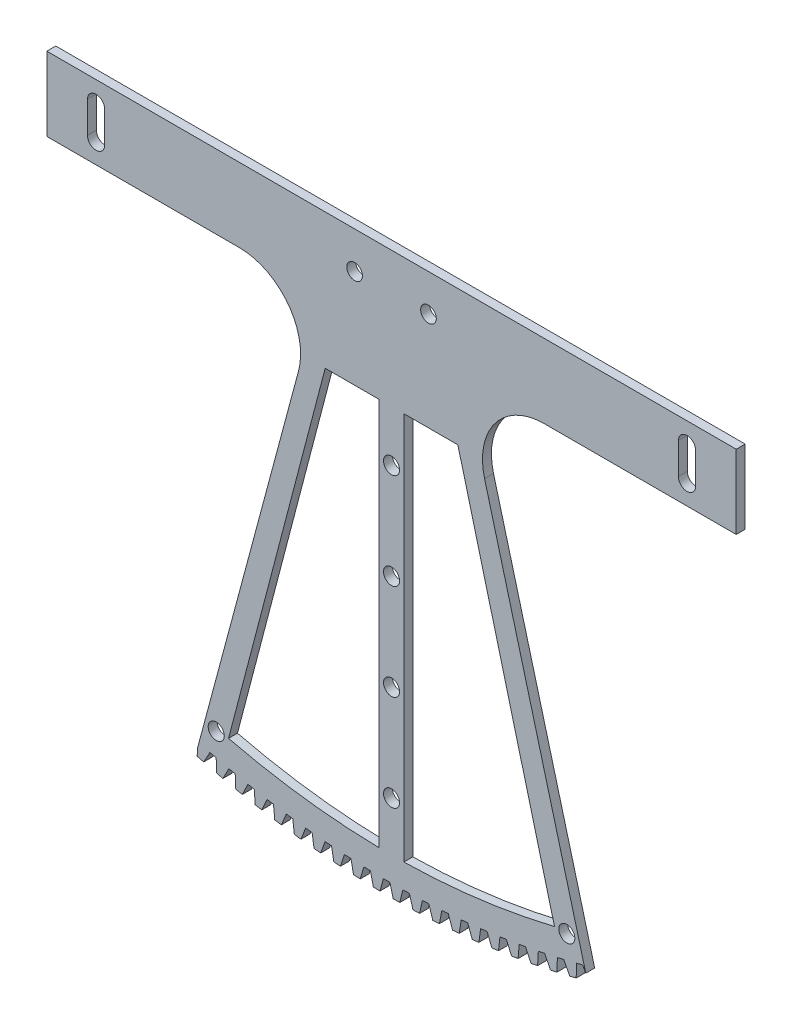
from build123d import *

# Parameters (mm, degrees)
BOSS_EXTRUDE2_DEPTH = 3.628571429
FILLET1_R           = 25
BOSS_EXTRUDE4_DEPTH = 3.628571429
CUT_EXTRUDE2_DEPTH  = 336.434355024
CIRPATTERN8_COUNT   = 20
CIRPATTERN8_ANGLE   = 28.5
SKETCH5_R           = 3.175
CUT_EXTRUDE3_DEPTH  = 338.743409804
SKETCH17_R          = 3.2639
CUT_EXTRUDE4_DEPTH  = 338.743409804


with BuildPart() as part:
    # Sketch3 → Boss-Extrude2 (new body)
    with BuildSketch(Plane.XY):
        with BuildLine():
            Line((-140, -79.56), (-140, -109.56))
            Line((-140, -109.56), (-29.356513523, -109.56))
            Line((-29.356513523, -109.56), (-78.888044947, -294.414191853))
            ThreePointArc((-78.888044947, -294.414191853), (0, -304.8), (78.888044947, -294.414191853))
            Line((78.888044947, -294.414191853), (29.356513523, -109.56))
            Line((29.356513523, -109.56), (140, -109.56))
            Line((140, -109.56), (140, -79.56))
            Line((140, -79.56), (-140, -79.56))
        make_face()
    extrude(amount=BOSS_EXTRUDE2_DEPTH)

    # Fillet1
    fillet1_edges = [part.edges().sort_by_distance(p)[0] for p in [
        (29.356513523, -109.56, 1.814285714),
        (-29.356513523, -109.56, 1.814285714),
    ]]
    fillet(fillet1_edges, radius=FILLET1_R)

    # Sketch14 → Boss-Extrude4 (add)
    with BuildSketch(Plane(origin=(0, 0, 0), x_dir=(-1, 0, 0), z_dir=(0, 0, -1))):
        with BuildLine():
            Line((78.910933272, -297.036934084), (78.888044947, -294.414191853))
            ThreePointArc((78.888044947, -294.414191853), (76.959432674, -294.924203351), (75.027523715, -295.421581279))
            Line((75.027523715, -295.421581279), (76.289081309, -297.721097125))
            Line((76.289081309, -297.721097125), (78.910933272, -297.036934084))
        make_face()
    boss_extrude4 = extrude(amount=-BOSS_EXTRUDE4_DEPTH)

    # Sketch16 → Cut-Extrude2 (cut, symmetric)
    with BuildSketch(Plane(origin=(0, 0, 0), x_dir=(-1, 0, 0), z_dir=(0, 0, -1))):
        Polygon((372.937709596, -838.440145613), (75.027523715, -295.421581279), (73.765262731, -293.12078332), (71.19993834, -293.754449124), (71.154137831, -296.378353915), (60.344615656, -915.654378233), (357.400151379, -2118.250141136), (669.993245319, -2041.035908516), align=None)
    cut_extrude2 = extrude(amount=CUT_EXTRUDE2_DEPTH, both=True, mode=Mode.SUBTRACT)

    # CirPattern8: Boss-Extrude4, Cut-Extrude2 ×20 about axis
    cirpattern8_axis = Axis((0, 0, 0), (0, 0, 1))
    add([boss_extrude4.rotate(cirpattern8_axis, i * CIRPATTERN8_ANGLE / (CIRPATTERN8_COUNT - 1)) for i in range(1, CIRPATTERN8_COUNT)])
    add([cut_extrude2.rotate(cirpattern8_axis, i * CIRPATTERN8_ANGLE / (CIRPATTERN8_COUNT - 1)) for i in range(1, CIRPATTERN8_COUNT)], mode=Mode.SUBTRACT)

    # Sketch5 → Cut-Extrude3 (cut, through all)
    with BuildSketch(Plane(origin=(0, 0, 0), x_dir=(-1, 0, 0), z_dir=(0, 0, -1))):
        with Locations((-15, -94.56)):
            Circle(SKETCH5_R)
        with Locations((15, -94.56)):
            Circle(SKETCH5_R)
        with BuildLine():
            Line((-123.5, -94.56), (-123.5, -100.91))
            ThreePointArc((-123.5, -100.91), (-120, -104.41), (-116.5, -100.91))
            Line((-116.5, -100.91), (-116.5, -94.56))
            Line((-116.5, -94.56), (-116.5, -88.21))
            ThreePointArc((-116.5, -88.21), (-120, -84.71), (-123.5, -88.21))
            Line((-123.5, -88.21), (-123.5, -94.56))
        make_face()
        with BuildLine():
            Line((116.5, -94.56), (116.5, -88.21))
            ThreePointArc((116.5, -88.21), (120, -84.71), (123.5, -88.21))
            Line((123.5, -88.21), (123.5, -94.56))
            Line((123.5, -94.56), (123.5, -100.91))
            ThreePointArc((123.5, -100.91), (120, -104.41), (116.5, -100.91))
            Line((116.5, -100.91), (116.5, -94.56))
        make_face()
    extrude(amount=-CUT_EXTRUDE3_DEPTH, mode=Mode.SUBTRACT)

    # Sketch17 → Cut-Extrude4 (cut, through all)
    with BuildSketch(Plane(origin=(0, 0, 0), x_dir=(-1, 0, 0), z_dir=(0, 0, -1))):
        with BuildLine():
            Line((66.194365296, -284.361242536), (26.937147844, -134.56))
            Line((26.937147844, -134.56), (5, -134.56))
            Line((5, -134.56), (5, -292.259285824))
            ThreePointArc((5, -292.259285824), (35.815557854, -290.00224429), (66.194365296, -284.361242536))
        make_face()
        with BuildLine():
            ThreePointArc((-66.194365296, -284.361242536), (-35.815557854, -290.00224429), (-5, -292.259285824))
            Line((-5, -292.259285824), (-5, -134.56))
            Line((-5, -134.56), (-26.937147844, -134.56))
            Line((-26.937147844, -134.56), (-66.194365296, -284.361242536))
        make_face()
        with Locations((0, -272.259285824)):
            Circle(SKETCH17_R)
        with Locations((0, -233.259285824)):
            Circle(SKETCH17_R)
        with Locations((0, -194.259285824)):
            Circle(SKETCH17_R)
        with Locations((0, -155.259285824)):
            Circle(SKETCH17_R)
        with Locations((-71.194365296, -284.361242536)):
            Circle(SKETCH17_R)
        with Locations((71.194365296, -284.361242536)):
            Circle(SKETCH17_R)
    extrude(amount=-CUT_EXTRUDE4_DEPTH, mode=Mode.SUBTRACT)


solid = part.part
